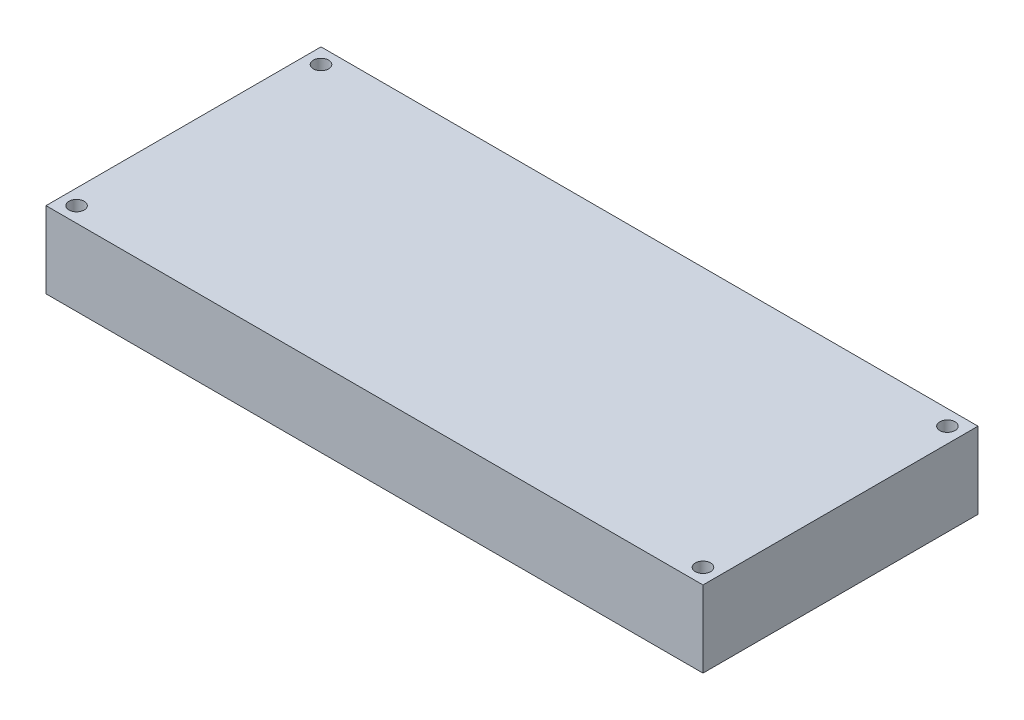
from build123d import *

# Parameters (mm, degrees)
SCHIZZO1_W                   = 43
SCHIZZO1_H                   = 18
ESTRUSIONE_ESTRUSIONE1_DEPTH = 5
SCHIZZO2_R                   = 0.5
TAGLIO_ESTRUSIONE1_DEPTH     = 5


with BuildPart() as part:
    # Schizzo1 → Estrusione-Estrusione1 (new body)
    with BuildSketch(Plane(origin=(0, 0, 0), x_dir=(1, 0, 0), z_dir=(0, 1, 0))):
        Rectangle(SCHIZZO1_W, SCHIZZO1_H)
    extrude(amount=ESTRUSIONE_ESTRUSIONE1_DEPTH)

    # Schizzo2 → Taglio-Estrusione1 (cut)
    with BuildSketch(Plane(origin=(0, 5, 0), x_dir=(1, 0, 0), z_dir=(0, 1, 0))):
        with Locations(Location((-20.5, 8, 0), (0, 0, 270))):
            Circle(SCHIZZO2_R)
        with Locations(Location((20.5, 8, 0), (0, 0, 270))):
            Circle(SCHIZZO2_R)
        with Locations(Location((20.5, -8, 0), (0, 0, 270))):
            Circle(SCHIZZO2_R)
        with Locations(Location((-20.5, -8, 0), (0, 0, 270))):
            Circle(SCHIZZO2_R)
    extrude(amount=-TAGLIO_ESTRUSIONE1_DEPTH, mode=Mode.SUBTRACT)


solid = part.part
